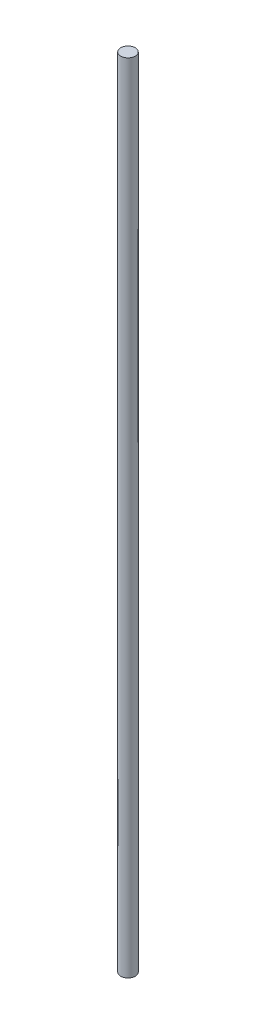
from build123d import *

# Parameters (mm, degrees)
SKETCH1_R           = 2.5
BOSS_EXTRUDE1_DEPTH = 274.2


with BuildPart() as part:
    # Sketch1 → Boss-Extrude1 (new body)
    with BuildSketch(Plane(origin=(0, 0, 0), x_dir=(1, 0, 0), z_dir=(0, 1, 0))):
        with Locations(Location((0, 0, 0), (0, 0, 270))):
            Circle(SKETCH1_R)
    extrude(amount=BOSS_EXTRUDE1_DEPTH)


solid = part.part
